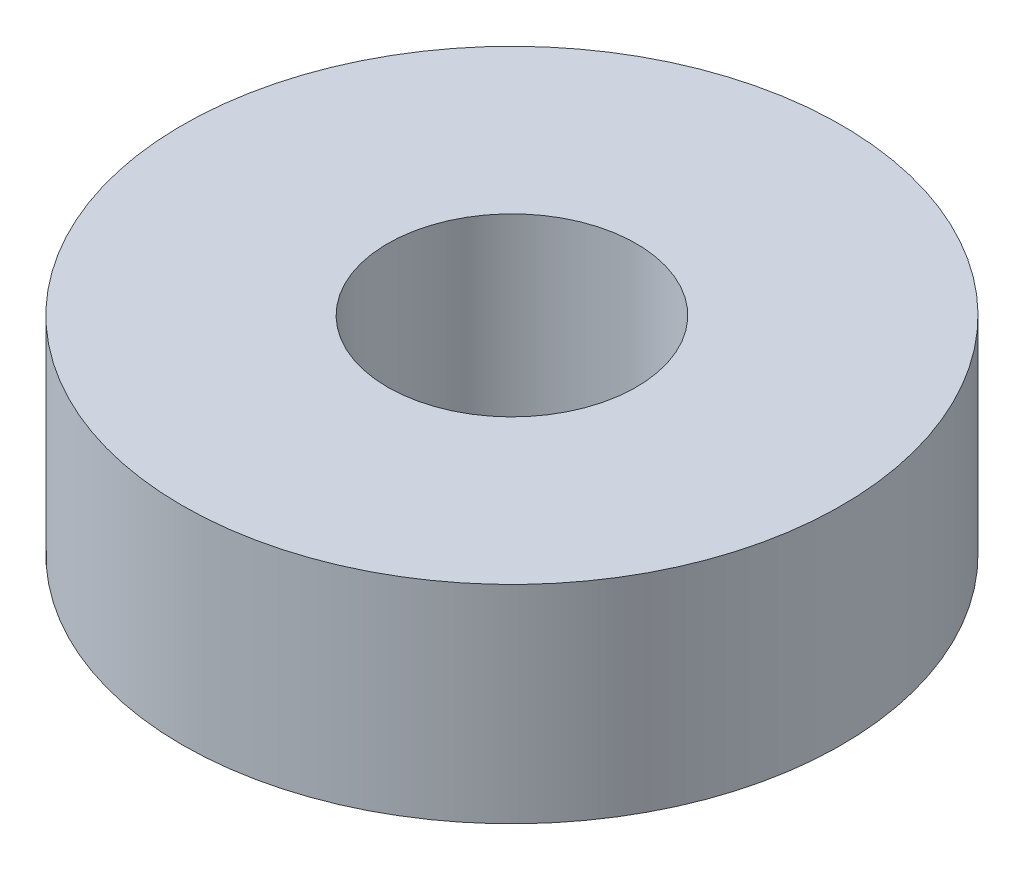
from build123d import *

# Parameters (mm, degrees)
SKETCH1_R           = 7.95
SKETCH1_R_2         = 3
BOSS_EXTRUDE1_DEPTH = 5


with BuildPart() as part:
    # Sketch1 → Boss-Extrude1 (new body)
    with BuildSketch(Plane(origin=(0, 0, 0), x_dir=(1, 0, 0), z_dir=(0, 1, 0))):
        with Locations(Location((0, 0, 0), (0, 0, 270))):
            Circle(SKETCH1_R)
        with Locations(Location((0, 0, 0), (0, 0, 270))):
            Circle(SKETCH1_R_2, mode=Mode.SUBTRACT)
    extrude(amount=BOSS_EXTRUDE1_DEPTH)


solid = part.part
